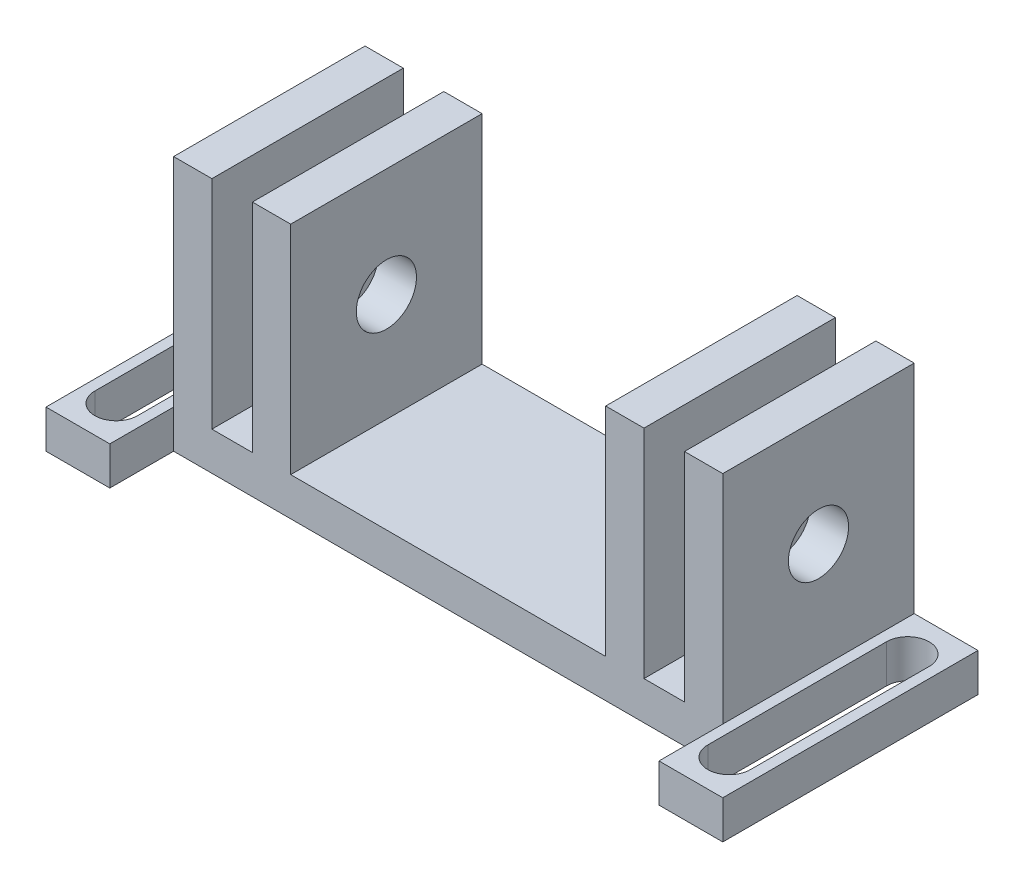
from build123d import *

# Parameters (mm, degrees)
SKETCH1_W               = 30.6846
SKETCH1_H               = 15
BOSS_EXTRUDE1_DEPTH     = 3
SKETCH2_W               = 3
SKETCH2_H               = 15
BOSS_EXTRUDE2_DEPTH     = 17
SKETCH4_W               = 3.175
SKETCH4_H               = 3
BOSS_EXTRUDE3_DEPTH     = 15
CUT_EXTRUDE1_DEPTH      = 43.601409744
CUT_EXTRUDE1_DEPTH_BACK = 43.601409744
SKETCH3_R               = 2.358188849
SKETCH5_W               = 5
SKETCH5_H               = 20
BOSS_EXTRUDE4_DEPTH     = 3


with BuildPart() as part:
    # Sketch1 → Boss-Extrude1 (new body)
    with BuildSketch(Plane(origin=(0, 0, 0), x_dir=(1, 0, 0), z_dir=(0, 1, 0))):
        Rectangle(SKETCH1_W, SKETCH1_H)
    extrude(amount=BOSS_EXTRUDE1_DEPTH)

    # Sketch2 → Boss-Extrude2 (add)
    with BuildSketch(Plane(origin=(0, 3, 0), x_dir=(1, 0, 0), z_dir=(0, 1, 0))):
        with Locations((-13.8423, 0)):
            Rectangle(SKETCH2_W, SKETCH2_H)
        with Locations((13.8423, 0)):
            Rectangle(SKETCH2_W, SKETCH2_H)
    extrude(amount=BOSS_EXTRUDE2_DEPTH)

    # Sketch4 → Boss-Extrude3 (add)
    with BuildSketch(Plane.XY.offset(7.5)):
        Polygon((-18.5173, 0), (-18.5173, 3), (-18.5173, 20), (-21.5173, 20), (-21.5173, 0), align=None)
        with Locations((-16.9298, 1.5)):
            Rectangle(SKETCH4_W, SKETCH4_H)
        with Locations((16.9298, 1.5)):
            Rectangle(SKETCH4_W, SKETCH4_H)
        Polygon((18.5173, 20), (18.5173, 3), (18.5173, 0), (21.5173, 0), (21.5173, 20), align=None)
    extrude(amount=-BOSS_EXTRUDE3_DEPTH)

    # Sketch3 → Cut-Extrude1 (cut, two sides: drawn at the far end of the back side and taken through both)
    with BuildSketch(Plane.ZY.offset(15.3423).offset(-CUT_EXTRUDE1_DEPTH_BACK)):
        with Locations((0, 11.477245264)):
            Circle(SKETCH3_R)
    extrude(amount=CUT_EXTRUDE1_DEPTH + CUT_EXTRUDE1_DEPTH_BACK, mode=Mode.SUBTRACT)

    # Sketch5 → Boss-Extrude4 (add)
    # profile 1 of 2: a face of its own
    with BuildSketch(Plane(origin=(0, 0, 0), x_dir=(-1, 0, 0), z_dir=(0, -1, 0))):
        with Locations((24.0173, -2.5)):
            Rectangle(SKETCH5_W, SKETCH5_H)
        with BuildLine():
            Line((25.6923, 4.5), (25.6923, -9.5))
            ThreePointArc((25.6923, -9.5), (24.0173, -11.175), (22.3423, -9.5))
            Line((22.3423, -9.5), (22.3423, 4.5))
            ThreePointArc((22.3423, 4.5), (24.0173, 6.175), (25.6923, 4.5))
        make_face(mode=Mode.SUBTRACT)
    # profile 2 of 2: a face of its own
    with BuildSketch(Plane(origin=(0, 0, 0), x_dir=(-1, 0, 0), z_dir=(0, -1, 0))):
        with Locations((-24.0173, -2.5)):
            Rectangle(SKETCH5_W, SKETCH5_H)
        with BuildLine():
            Line((-22.3423, 4.5), (-22.3423, -9.5))
            ThreePointArc((-22.3423, -9.5), (-24.0173, -11.175), (-25.6923, -9.5))
            Line((-25.6923, -9.5), (-25.6923, 4.5))
            ThreePointArc((-25.6923, 4.5), (-24.0173, 6.175), (-22.3423, 4.5))
        make_face(mode=Mode.SUBTRACT)
    extrude(amount=-BOSS_EXTRUDE4_DEPTH)


solid = part.part
